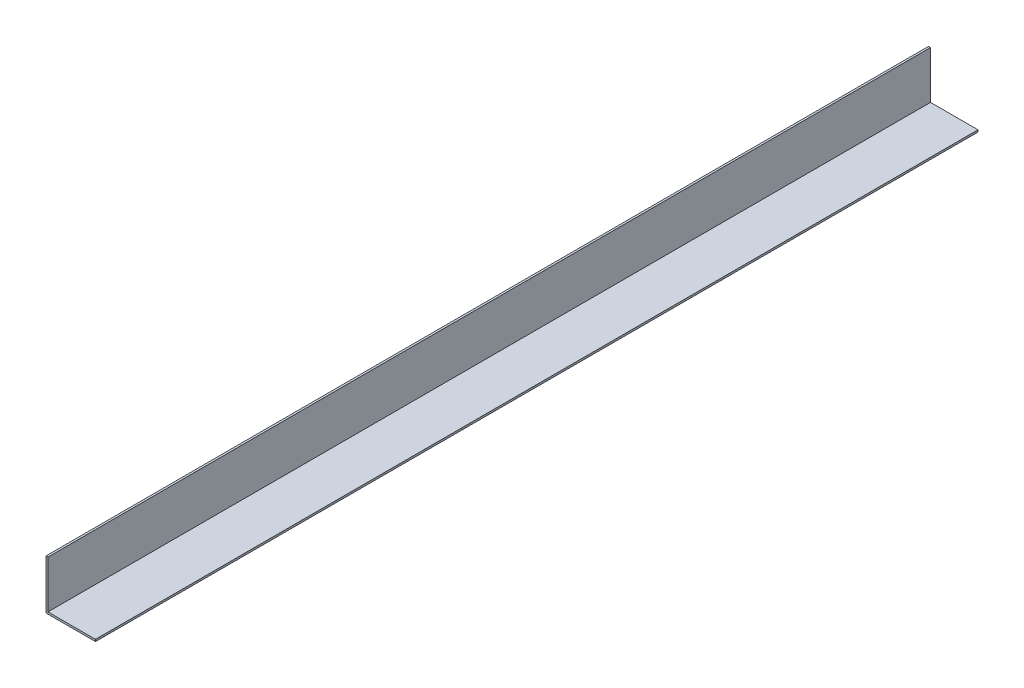
from build123d import *

# Parameters (mm, degrees)
BOSS_EXTRUDE1_DEPTH = 267.5


with BuildPart() as part:
    # Sketch1 → Boss-Extrude1 (new, symmetric)
    with BuildSketch(Plane.XY):
        Polygon((0, 30), (0, 0), (30, 0), (30, 1.2), (1.2, 1.2), (1.2, 30), align=None)
    extrude(amount=BOSS_EXTRUDE1_DEPTH, both=True)


solid = part.part
